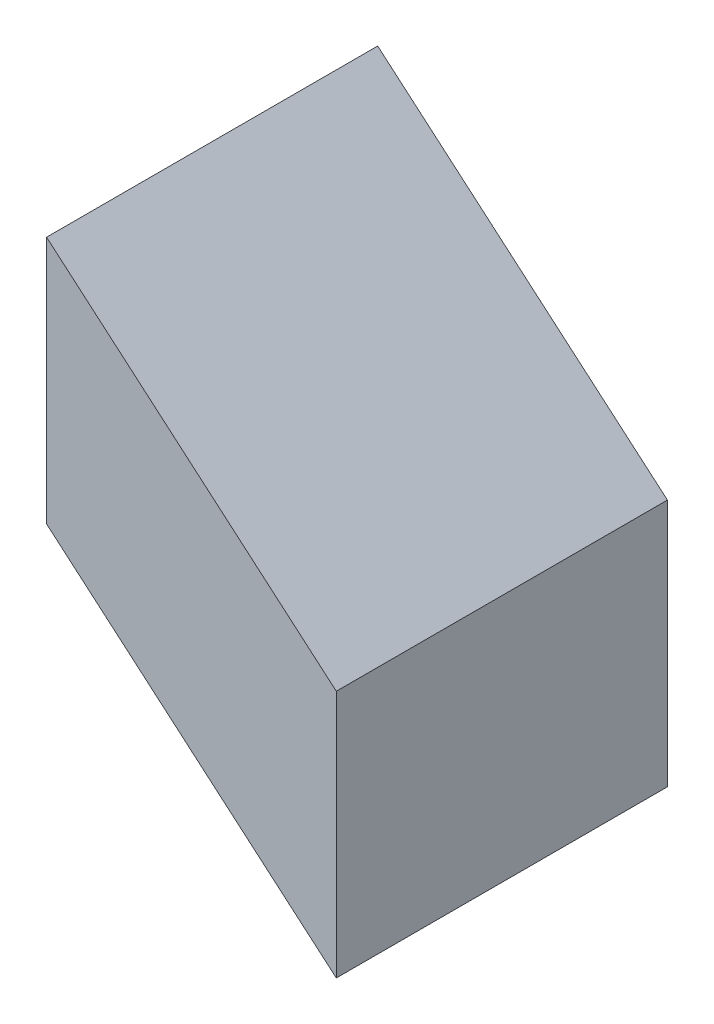
from build123d import *

# Parameters (mm, degrees)
BOSS_EXTRUDE1_DEPTH = 50.8


with BuildPart() as part:
    # Sketch1 → Boss-Extrude1 (new body)
    with BuildSketch(Plane.XY):
        Polygon((0, 0), (0, -38.1), (-44.45, 0), (-44.45, 38.1), align=None)
    extrude(amount=BOSS_EXTRUDE1_DEPTH)


solid = part.part
